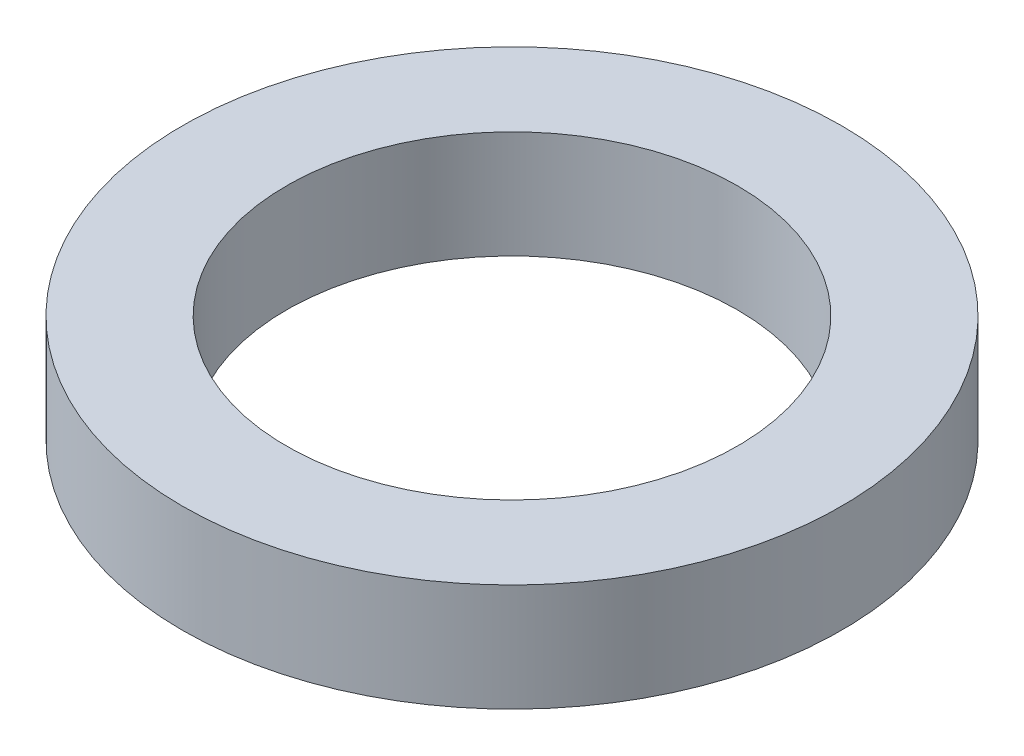
from build123d import *

# Parameters (mm, degrees)
SKETCH_1_R      = 9.5
SKETCH_1_R_2    = 6.5
EXTRUDE_1_DEPTH = 3.1


with BuildPart() as part:
    # 草图1 → 凸台-拉伸1 (new body)
    with BuildSketch(Plane(origin=(0, 0, 0), x_dir=(1, 0, 0), z_dir=(0, 1, 0))):
        with Locations(Location((0, 0, 0), (0, 0, 90))):
            Circle(SKETCH_1_R)
        with Locations(Location((0, 0, 0), (0, 0, 90))):
            Circle(SKETCH_1_R_2, mode=Mode.SUBTRACT)
    extrude(amount=EXTRUDE_1_DEPTH)


solid = part.part
